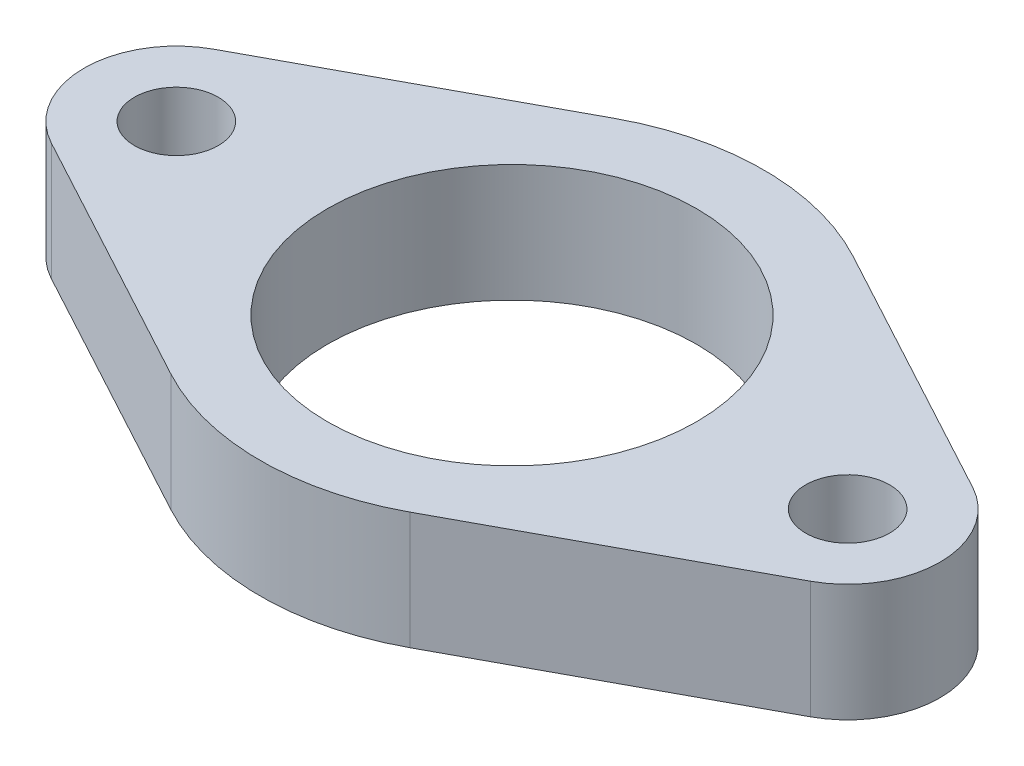
from build123d import *

# Parameters (mm, degrees)
SKETCH1_R           = 11
SKETCH1_R_2         = 2.5
BOSS_EXTRUDE1_DEPTH = 7


with BuildPart() as part:
    # Sketch1 → Boss-Extrude1 (new body)
    with BuildSketch(Plane(origin=(0, 0, 0), x_dir=(1, 0, 0), z_dir=(0, 1, 0))):
        with BuildLine():
            Line((-22.6125, 4.839921874), (-7.125, 13.19978693))
            ThreePointArc((-7.125, 13.19978693), (0, 15), (7.125, 13.19978693))
            Line((7.125, 13.19978693), (22.6125, 4.839921874))
            ThreePointArc((22.6125, 4.839921874), (25.5, 0), (22.6125, -4.839921874))
            Line((22.6125, -4.839921874), (7.125, -13.19978693))
            ThreePointArc((7.125, -13.19978693), (0, -15), (-7.125, -13.19978693))
            Line((-7.125, -13.19978693), (-22.6125, -4.839921874))
            ThreePointArc((-22.6125, -4.839921874), (-25.5, 0), (-22.6125, 4.839921874))
        make_face()
        with Locations(Location((0, 0, 0), (0, 0, 270))):
            Circle(SKETCH1_R, mode=Mode.SUBTRACT)
        with Locations(Location((-20, 0, 0), (0, 0, 270))):
            Circle(SKETCH1_R_2, mode=Mode.SUBTRACT)
        with Locations(Location((20, 0, 0), (0, 0, 90))):
            Circle(SKETCH1_R_2, mode=Mode.SUBTRACT)
    extrude(amount=BOSS_EXTRUDE1_DEPTH)


solid = part.part
